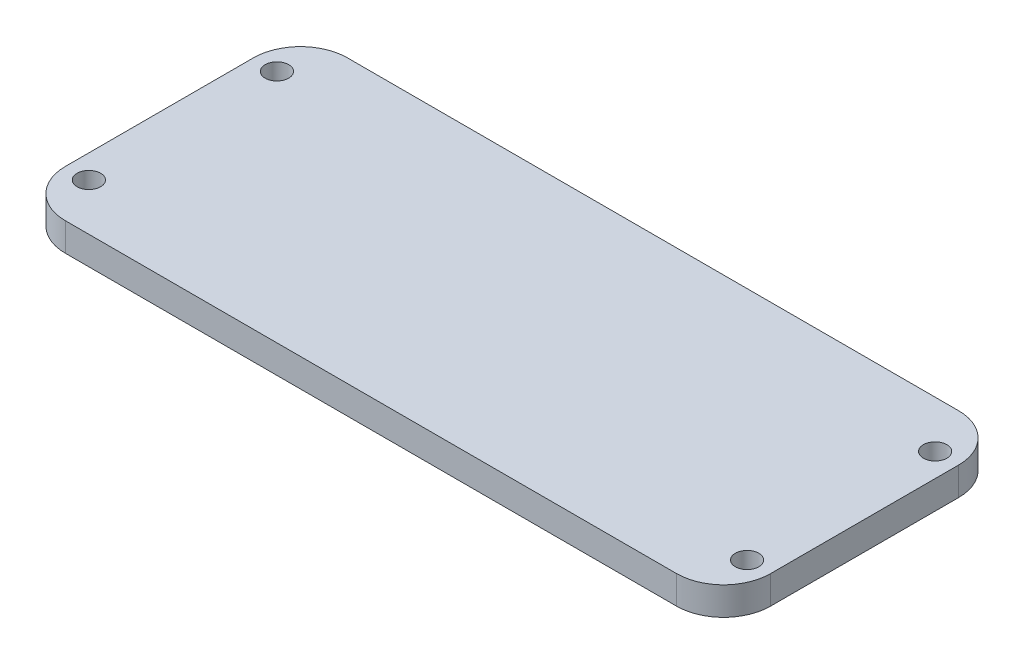
from build123d import *

# Parameters (mm, degrees)
SALIENTE_EXTRUIR1_DEPTH   = 2.8
SALIENTE_EXTRUIR1_2_DEPTH = 2.8
SALIENTE_EXTRUIR2_DEPTH   = 3
CROQUIS3_R                = 2.5
SALIENTE_EXTRUIR3_DEPTH   = 6


with BuildPart() as part:
    # Croquis1 → Saliente-Extruir1 (new body)
    with BuildSketch(Plane(origin=(0, 0, 0), x_dir=(1, 0, 0), z_dir=(0, 1, 0))):
        with BuildLine():
            Line((-32, -14.5), (-13, -14.5))
            ThreePointArc((-13, -14.5), (-9.464466094, -13.035533906), (-8, -9.5))
            Line((-8, -9.5), (-8, 9.5))
            ThreePointArc((-8, 9.5), (-9.464466094, 13.035533906), (-13, 14.5))
            Line((-13, 14.5), (-32, 14.5))
            ThreePointArc((-32, 14.5), (-35.535533906, 13.035533906), (-37, 9.5))
            Line((-37, 9.5), (-37, -9.5))
            ThreePointArc((-37, -9.5), (-35.535533906, -13.035533906), (-32, -14.5))
        make_face()
    extrude(amount=SALIENTE_EXTRUIR1_DEPTH)



with BuildPart() as body_2:
    # Croquis1 → Saliente-Extruir1 2 (new body)
    with BuildSketch(Plane(origin=(0, 0, 0), x_dir=(1, 0, 0), z_dir=(0, 1, 0))):
        with BuildLine():
            Line((13, -14.5), (32, -14.5))
            ThreePointArc((32, -14.5), (35.535533906, -13.035533906), (37, -9.5))
            Line((37, -9.5), (37, 9.5))
            ThreePointArc((37, 9.5), (35.535533906, 13.035533906), (32, 14.5))
            Line((32, 14.5), (13, 14.5))
            ThreePointArc((13, 14.5), (9.464466094, 13.035533906), (8, 9.5))
            Line((8, 9.5), (8, -9.5))
            ThreePointArc((8, -9.5), (9.464466094, -13.035533906), (13, -14.5))
        make_face()
    extrude(amount=SALIENTE_EXTRUIR1_2_DEPTH)


with BuildPart() as part_1:
    add(part.part)

    add(body_2.part)  # Saliente-Extruir2 merges body 2
    # Croquis2 → Saliente-Extruir2 (add)
    with BuildSketch(Plane(origin=(0, 2.8, 0), x_dir=(1, 0, 0), z_dir=(0, 1, 0))):
        with BuildLine():
            Line((-33, -12.5), (-12, -12.5))
            ThreePointArc((-12, -12.5), (-10.585786438, -11.914213562), (-10, -10.5))
            Line((-10, -10.5), (-10, 10.5))
            ThreePointArc((-10, 10.5), (-10.585786438, 11.914213562), (-12, 12.5))
            Line((-12, 12.5), (-33, 12.5))
            ThreePointArc((-33, 12.5), (-34.414213562, 11.914213562), (-35, 10.5))
            Line((-35, 10.5), (-35, -10.5))
            ThreePointArc((-35, -10.5), (-34.414213562, -11.914213562), (-33, -12.5))
        make_face()
        with BuildLine():
            Line((12, -12.5), (33, -12.5))
            ThreePointArc((33, -12.5), (34.414213562, -11.914213562), (35, -10.5))
            Line((35, -10.5), (35, 10.5))
            ThreePointArc((35, 10.5), (34.414213562, 11.914213562), (33, 12.5))
            Line((33, 12.5), (12, 12.5))
            ThreePointArc((12, 12.5), (10.585786438, 11.914213562), (10, 10.5))
            Line((10, 10.5), (10, -10.5))
            ThreePointArc((10, -10.5), (10.585786438, -11.914213562), (12, -12.5))
        make_face()
    extrude(amount=SALIENTE_EXTRUIR2_DEPTH)


with BuildPart() as body_2_2:
    # Croquis3 → Saliente-Extruir3 (new body)
    with BuildSketch(Plane(origin=(0, 6.5, 0), x_dir=(1, 0, 0), z_dir=(0, 1, 0))):
        with BuildLine():
            Line((65, -30), (-65, -30))
            ThreePointArc((-65, -30), (-72.071067812, -27.071067812), (-75, -20))
            Line((-75, -20), (-75, 20))
            ThreePointArc((-75, 20), (-72.071067812, 27.071067812), (-65, 30))
            Line((-65, 30), (65, 30))
            ThreePointArc((65, 30), (72.071067812, 27.071067812), (75, 20))
            Line((75, 20), (75, -20))
            ThreePointArc((75, -20), (72.071067812, -27.071067812), (65, -30))
        make_face()
        with Locations(Location((-70, 20, 0), (0, 0, 270))):
            Circle(CROQUIS3_R, mode=Mode.SUBTRACT)
        with Locations(Location((-70, -20, 0), (0, 0, 270))):
            Circle(CROQUIS3_R, mode=Mode.SUBTRACT)
        with Locations(Location((70, -20, 0), (0, 0, 90))):
            Circle(CROQUIS3_R, mode=Mode.SUBTRACT)
        with Locations(Location((70, 20, 0), (0, 0, 90))):
            Circle(CROQUIS3_R, mode=Mode.SUBTRACT)
    extrude(amount=SALIENTE_EXTRUIR3_DEPTH)


solid = Compound([part_1.part, body_2_2.part])
